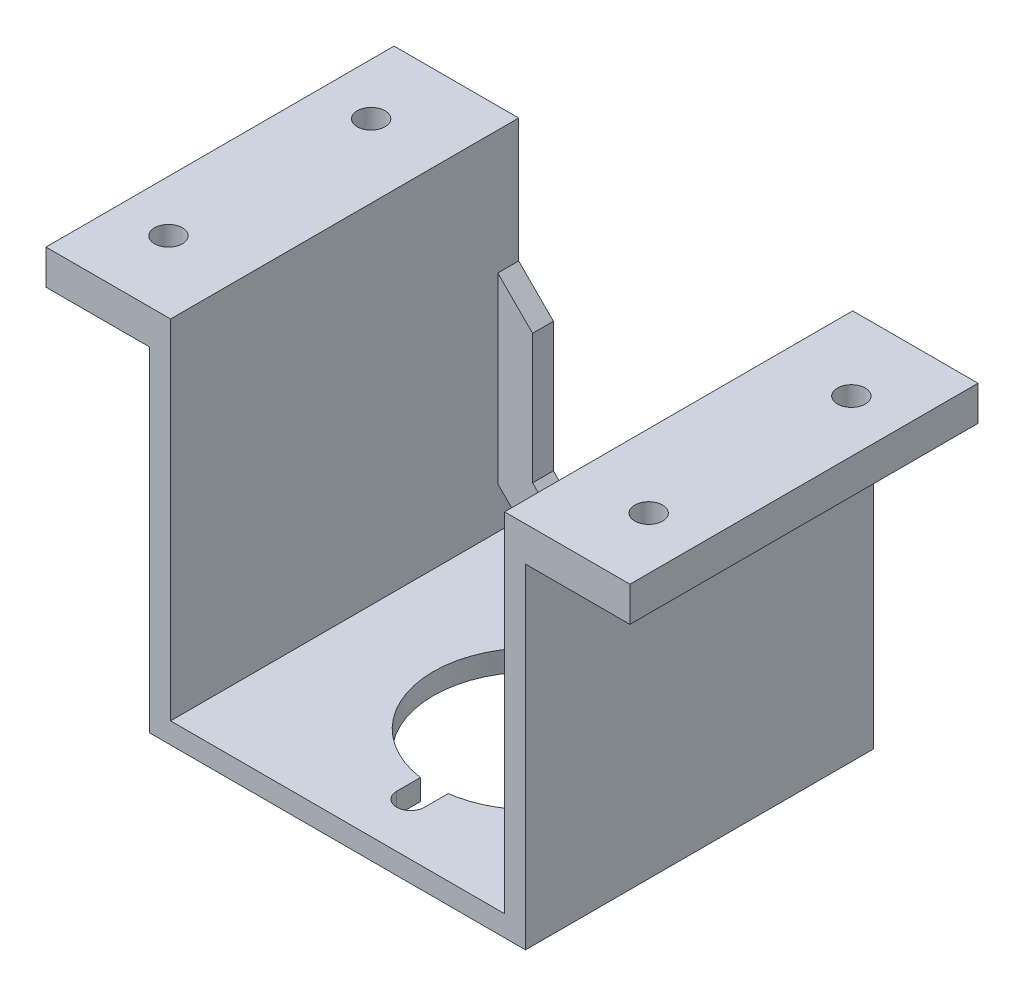
from build123d import *

# Parameters (mm, degrees)
SKETCH1_W                = 50
SKETCH1_H                = 40
BOSS_EXTRUDE1_DEPTH      = 3
SKETCH6_R                = 2
CUT_EXTRUDE9_DEPTH       = 5
SKETCH16_W               = 14.8
SKETCH16_H               = 3
CUT_EXTRUDE10_DEPTH      = 0.5
SKETCH21_R               = 14.25
CUT_EXTRUDE15_DEPTH      = 4
CUT_EXTRUDE16_START      = -4
CUT_EXTRUDE16_DEPTH      = 4
SKETCH33_W               = 4
SKETCH33_H               = 35
CUT_EXTRUDE23_DEPTH      = 5
SKETCH34_W               = 49.986920535
SKETCH34_H               = 3
BOSS_EXTRUDE2_DEPTH      = 3
SKETCH35_W               = 50
SKETCH35_H               = 3
BOSS_EXTRUDE3_DEPTH      = 3
SKETCH36_W               = 46
SKETCH36_H               = 3
BOSS_EXTRUDE4_DEPTH      = 4
SKETCH38_W               = 3
SKETCH38_H               = 46
BOSS_EXTRUDE5_DEPTH      = 25
SKETCH39_W               = 45.535565308
SKETCH39_H               = 3
BOSS_EXTRUDE6_DEPTH      = 15
SKETCH40_W               = 46
SKETCH40_H               = 3
BOSS_EXTRUDE7_DEPTH      = 15
SKETCH41_W               = 0.464434692
SKETCH41_H               = 3
BOSS_EXTRUDE8_DEPTH      = 15
SKETCH42_R               = 2
CUT_EXTRUDE24_DEPTH      = 15
SKETCH43_R               = 2
CUT_EXTRUDE25_DEPTH      = 15
BOSS_EXTRUDE10_START     = 1
SKETCH44_W               = 14.986920535
SKETCH44_H               = 46
SKETCH44_R               = 2
BOSS_EXTRUDE10_DEPTH     = 1
BOSS_EXTRUDE11_START     = 1
SKETCH46_W               = 15
SKETCH46_H               = 46
SKETCH46_R               = 2
BOSS_EXTRUDE11_DEPTH     = 1
BOSS_EXTRUDE12_DEPTH     = 2
BOSS_EXTRUDE13_DEPTH     = 2
SKETCH49_W               = 47.986920535
SKETCH49_H               = 2
BOSS_EXTRUDE14_DEPTH     = 10
CUT_EXTRUDE26_DEPTH      = 10
SKETCH51_W               = 15
SKETCH51_H               = 50
SKETCH51_R               = 2
SKETCH51_W_2             = 3.013079465
SKETCH51_W_3             = 3
BOSS_EXTRUDE15_DEPTH     = 25
CUT_EXTRUDE27_DEPTH      = 63.345980453
CUT_EXTRUDE27_DEPTH_BACK = 63.345980453
SKETCH53_R               = 2
SKETCH54_W               = 15
SKETCH54_H               = 50
CUT_EXTRUDE28_DEPTH      = 48
SKETCH55_W               = 46
SKETCH55_H               = 4
CUT_EXTRUDE29_DEPTH      = 3
SKETCH56_W               = 5
SKETCH56_H               = 5
BOSS_EXTRUDE18_DEPTH     = 1
BOSS_EXTRUDE19_DEPTH     = 2
CUT_EXTRUDE30_DEPTH      = 3


with BuildPart() as part:
    # Sketch1 → Boss-Extrude1 (new body)
    with BuildSketch(Plane(origin=(0, 0, 0), x_dir=(1, 0, 0), z_dir=(0, 1, 0))):
        with Locations((1.920937393, -5.615172506)):
            Rectangle(SKETCH1_W, SKETCH1_H)
    extrude(amount=BOSS_EXTRUDE1_DEPTH)

    # Sketch6 → Cut-Extrude9 (cut)
    with BuildSketch(Plane.XZ):
        with Locations(Location((6.920937393, 23.115172506, 0), (0, 0, 270))):
            Circle(SKETCH6_R)
        with Locations(Location((6.920937393, -11.884827494, 0), (0, 0, 270))):
            Circle(SKETCH6_R)
        with BuildLine():
            Line((24.420937393, 13.015172506), (18.923020545, 13.015172506))
            ThreePointArc((18.923020545, 13.015172506), (-7.179062607, 5.615172506), (18.923020545, -1.784827494))
            Line((18.923020545, -1.784827494), (24.420937393, -1.784827494))
            Line((24.420937393, -1.784827494), (24.420937393, 5.615172506))
            Line((24.420937393, 5.615172506), (24.420937393, 13.015172506))
        make_face()
    extrude(amount=-CUT_EXTRUDE9_DEPTH, mode=Mode.SUBTRACT)

    # Sketch16 → Cut-Extrude10 (cut)
    with BuildSketch(Plane.ZY.offset(-24.420937393)):
        with Locations((5.615172506, 1.5)):
            Rectangle(SKETCH16_W, SKETCH16_H)
    extrude(amount=-CUT_EXTRUDE10_DEPTH, mode=Mode.SUBTRACT)

    # Sketch21 → Cut-Extrude15 (cut)
    with BuildSketch(Plane(origin=(0, 0, 0), x_dir=(-1, 0, 0), z_dir=(0, -1, 0))):
        with Locations((-6.920937393, -5.615172506)):
            Circle(SKETCH21_R)
    extrude(amount=-CUT_EXTRUDE15_DEPTH, mode=Mode.SUBTRACT)

    # Sketch22 → Cut-Extrude16 (cut)
    with BuildSketch(Plane(origin=(0, 3, 0), x_dir=(1, 0, 0), z_dir=(0, 1, 0)).offset(CUT_EXTRUDE16_START)):
        with BuildLine():
            ThreePointArc((21.106680727, 1.784827494), (20.39103932, 3.019158274), (19.568281538, 4.184827494))
            Line((19.568281538, 4.184827494), (17.266105347, 4.184827494))
            ThreePointArc((17.266105347, 4.184827494), (18.246250908, 3.03351374), (19.09888878, 1.784827494))
            Line((19.09888878, 1.784827494), (21.106680727, 1.784827494))
        make_face()
        with BuildLine():
            Line((17.266105347, -15.415172506), (19.568281538, -15.415172506))
            ThreePointArc((19.568281538, -15.415172506), (20.39103932, -14.249503286), (21.106680727, -13.015172506))
            Line((21.106680727, -13.015172506), (19.09888878, -13.015172506))
            ThreePointArc((19.09888878, -13.015172506), (18.246250908, -14.263858752), (17.266105347, -15.415172506))
        make_face()
    extrude(amount=CUT_EXTRUDE16_DEPTH, mode=Mode.SUBTRACT)

    # Sketch33 → Cut-Extrude23 (cut)
    with BuildSketch(Plane(origin=(0, 3, 0), x_dir=(1, 0, 0), z_dir=(0, 1, 0))):
        with Locations((6.920937393, -5.615172506)):
            Rectangle(SKETCH33_W, SKETCH33_H)
    extrude(amount=-CUT_EXTRUDE23_DEPTH, mode=Mode.SUBTRACT)

    # Sketch34 → Boss-Extrude2 (add)
    with BuildSketch(Plane(origin=(0, 0, -14.384827494), x_dir=(-1, 0, 0), z_dir=(0, 0, -1))):
        with Locations((-1.927477126, 1.5)):
            Rectangle(SKETCH34_W, SKETCH34_H)
    extrude(amount=BOSS_EXTRUDE2_DEPTH)

    # Sketch35 → Boss-Extrude3 (add)
    with BuildSketch(Plane.XY.offset(25.615172506)):
        with Locations((1.920937393, 1.5)):
            Rectangle(SKETCH35_W, SKETCH35_H)
    extrude(amount=BOSS_EXTRUDE3_DEPTH)

    # Sketch36 → Boss-Extrude4 (add)
    with BuildSketch(Plane(origin=(26.920937393, 0, 0), x_dir=(0, 0, -1), z_dir=(1, 0, 0))):
        with Locations((-5.615172506, 1.5)):
            Rectangle(SKETCH36_W, SKETCH36_H)
    extrude(amount=BOSS_EXTRUDE4_DEPTH)

    # Sketch38 → Boss-Extrude5 (add)
    with BuildSketch(Plane(origin=(0, 3, 0), x_dir=(1, 0, 0), z_dir=(0, 1, 0))):
        with Locations((29.420937393, -5.615172506)):
            Rectangle(SKETCH38_W, SKETCH38_H)
        with Locations((-21.565983142, -5.615172506)):
            Rectangle(SKETCH38_W, SKETCH38_H)
    extrude(amount=BOSS_EXTRUDE5_DEPTH)

    # Sketch39 → Boss-Extrude6 (add)
    with BuildSketch(Plane.ZY.offset(23.065983142)):
        with Locations((5.38295516, 26.5)):
            Rectangle(SKETCH39_W, SKETCH39_H)
    extrude(amount=BOSS_EXTRUDE6_DEPTH)

    # Sketch40 → Boss-Extrude7 (add)
    with BuildSketch(Plane(origin=(30.920937393, 0, 0), x_dir=(0, 0, -1), z_dir=(1, 0, 0))):
        with Locations((-5.615172506, 26.5)):
            Rectangle(SKETCH40_W, SKETCH40_H)
    extrude(amount=BOSS_EXTRUDE7_DEPTH)

    # Sketch41 → Boss-Extrude8 (add)
    with BuildSketch(Plane.ZY.offset(23.065983142)):
        with Locations((28.38295516, 26.5)):
            Rectangle(SKETCH41_W, SKETCH41_H)
    extrude(amount=BOSS_EXTRUDE8_DEPTH)

    # Sketch42 → Cut-Extrude24 (cut)
    with BuildSketch(Plane.XZ.offset(-25)):
        with Locations(Location((38.420937393, 20.419520332, 0), (0, 0, 270))):
            Circle(SKETCH42_R)
        with Locations(Location((38.420937393, -8.692413747, 0), (0, 0, 270))):
            Circle(SKETCH42_R)
    extrude(amount=-CUT_EXTRUDE24_DEPTH, mode=Mode.SUBTRACT)

    # Sketch43 → Cut-Extrude25 (cut)
    with BuildSketch(Plane.XZ.offset(-25)):
        with Locations(Location((-30.565983142, 20.419520332, 0), (0, 0, 270))):
            Circle(SKETCH43_R)
        with Locations(Location((-30.565983142, -8.692413747, 0), (0, 0, 270))):
            Circle(SKETCH43_R)
    extrude(amount=-CUT_EXTRUDE25_DEPTH, mode=Mode.SUBTRACT)

    # Sketch44 → Boss-Extrude10 (add)
    with BuildSketch(Plane.XZ.offset(-25).offset(BOSS_EXTRUDE10_START)):
        with Locations((-30.572522875, 5.615172506)):
            Rectangle(SKETCH44_W, SKETCH44_H)
        with Locations(Location((-30.565983142, -8.692413747, 0), (0, 0, 270))):
            Circle(SKETCH44_R, mode=Mode.SUBTRACT)
        with Locations(Location((-30.565983142, 20.419520332, 0), (0, 0, 270))):
            Circle(SKETCH44_R, mode=Mode.SUBTRACT)
    extrude(amount=-BOSS_EXTRUDE10_DEPTH)

    # Sketch46 → Boss-Extrude11 (add)
    with BuildSketch(Plane.XZ.offset(-25).offset(BOSS_EXTRUDE11_START)):
        with Locations((38.420937393, 5.615172506)):
            Rectangle(SKETCH46_W, SKETCH46_H)
        with Locations(Location((38.420937393, -8.692413747, 0), (0, 0, 270))):
            Circle(SKETCH46_R, mode=Mode.SUBTRACT)
        with Locations(Location((38.420937393, 20.419520332, 0), (0, 0, 270))):
            Circle(SKETCH46_R, mode=Mode.SUBTRACT)
    extrude(amount=-BOSS_EXTRUDE11_DEPTH)

    # Sketch47 → Boss-Extrude12 (add)
    with BuildSketch(Plane(origin=(0, 0, -17.384827494), x_dir=(-1, 0, 0), z_dir=(0, 0, -1))):
        Polygon((-27.920937393, 28), (-45.920937393, 28), (-45.920937393, 24), (-30.920937393, 24), (-30.920937393, 0), (23.065983142, 0), (23.065983142, 3), (23.065983142, 25), (23.079062607, 25), (23.079062607, 24), (37.960253495, 24), (37.960253495, 28), (20.065983142, 28), (20.065983142, 3), (-27.920937393, 3), align=None)
    extrude(amount=BOSS_EXTRUDE12_DEPTH)

    # Sketch48 → Boss-Extrude13 (add)
    with BuildSketch(Plane.XY.offset(28.615172506)):
        Polygon((-20.065983142, 28), (-37.960253495, 28), (-37.960253495, 24), (-23.079062607, 24), (-23.079062607, 25), (-23.065983142, 25), (-23.065983142, 3), (-23.065983142, 0), (30.920937393, 0), (30.920937393, 24), (45.920937393, 24), (45.920937393, 28), (27.920937393, 28), (27.920937393, 3), (-20.065983142, 3), align=None)
    extrude(amount=BOSS_EXTRUDE13_DEPTH)

    # Sketch49 → Boss-Extrude14 (add)
    with BuildSketch(Plane(origin=(0, 3, 0), x_dir=(1, 0, 0), z_dir=(0, 1, 0))):
        with Locations((3.927477126, 18.384827494)):
            Rectangle(SKETCH49_W, SKETCH49_H)
    extrude(amount=BOSS_EXTRUDE14_DEPTH)

    # Sketch50 → Cut-Extrude26 (cut)
    with BuildSketch(Plane.XY.offset(-17.384827494)):
        Polygon((-20.065983142, 13), (-9.830586805, 2.764603663), (17.920937393, 3), (27.920937393, 13), align=None)
    extrude(amount=-CUT_EXTRUDE26_DEPTH, mode=Mode.SUBTRACT)

    # Sketch51 → Boss-Extrude15 (add)
    # profile 1 of 4: a face of its own
    with BuildSketch(Plane(origin=(0, 28, 0), x_dir=(1, 0, 0), z_dir=(0, 1, 0))):
        with Locations((38.420937393, -5.615172506)):
            Rectangle(SKETCH51_W, SKETCH51_H)
        with Locations(Location((38.420937393, -20.419520332, 0), (0, 0, 90))):
            Circle(SKETCH51_R, mode=Mode.SUBTRACT)
        with Locations(Location((38.420937393, 8.692413747, 0), (0, 0, 90))):
            Circle(SKETCH51_R, mode=Mode.SUBTRACT)
    # profile 2 of 4: a face of its own
    with BuildSketch(Plane(origin=(0, 28, 0), x_dir=(1, 0, 0), z_dir=(0, 1, 0))):
        Polygon((-23.079062607, 19.384827494), (-37.960253495, 19.384827494), (-37.960253495, 17.384827494), (-37.960253495, -28.615172506), (-37.960253495, -30.615172506), (-23.079062607, -30.615172506), align=None)
    # profile 3 of 4: a face of its own
    with BuildSketch(Plane(origin=(0, 28, 0), x_dir=(1, 0, 0), z_dir=(0, 1, 0))):
        with Locations((-21.572522875, -5.615172506)):
            Rectangle(SKETCH51_W_2, SKETCH51_H)
    # profile 4 of 4: a face of its own
    with BuildSketch(Plane(origin=(0, 28, 0), x_dir=(1, 0, 0), z_dir=(0, 1, 0))):
        with Locations((29.420937393, -5.615172506)):
            Rectangle(SKETCH51_W_3, SKETCH51_H)
    extrude(amount=BOSS_EXTRUDE15_DEPTH)

    # Sketch53 → Cut-Extrude27 (cut, two sides: drawn at the far end of the back side and taken through both)
    with BuildSketch(Plane.XZ.offset(-24).offset(-CUT_EXTRUDE27_DEPTH_BACK)):
        with Locations(Location((-30.565983142, 20.419520332, 0), (0, 0, 270))):
            Circle(SKETCH53_R)
        with Locations(Location((-30.565983142, -8.692413747, 0), (0, 0, 270))):
            Circle(SKETCH53_R)
    extrude(amount=CUT_EXTRUDE27_DEPTH + CUT_EXTRUDE27_DEPTH_BACK, mode=Mode.SUBTRACT)

    # Sketch54 → Cut-Extrude28 (cut)
    with BuildSketch(Plane(origin=(0, 0, 0), x_dir=(-1, 0, 0), z_dir=(0, -1, 0))):
        Polygon((23.079062607, -30.615172506), (37.960253495, -30.615172506), (37.960253495, 19.384827494), (23.079062607, 19.384827494), (23.079062607, 14.384827494), (23.079062607, -28.615172506), align=None)
        with Locations((-38.420937393, -5.615172506)):
            Rectangle(SKETCH54_W, SKETCH54_H)
    extrude(amount=-CUT_EXTRUDE28_DEPTH, mode=Mode.SUBTRACT)


with BuildPart() as cut_extrude28_piece_1:
    # of the separate pieces the step leaves, piece 1, a body of its own (cut_extrude28_pieces)
    add(part.part.solids().sort_by_distance((-23.079062607, 0, -14.384827494))[0])

    # Sketch56 → Boss-Extrude18 (add)
    with BuildSketch(Plane.XY.offset(-17.384827494)):
        Polygon((-11.456856729, 8), (-15.065983142, 11.609126412), (-15.065983142, 8), align=None)
        Polygon((-6.456856729, 3), (-11.456856729, 8), (-15.065983142, 8), (-10.065983142, 3), align=None)
        Polygon((-15.065983142, 11.609126412), (-20.065983142, 16.609126412), (-20.065983142, 13), (-15.065983142, 8), align=None)
        Polygon((-20.065983142, 30.218252825), (-20.065983142, 16.609126412), (-15.065983142, 30.218252825), align=None)
        Polygon((-15.065983142, 30.218252825), (-20.065983142, 16.609126412), (-15.065983142, 11.609126412), align=None)
        Polygon((19.31181098, 8), (-11.456856729, 8), (-6.456856729, 3), (14.31181098, 3), align=None)
        Polygon((22.920937393, 8), (19.31181098, 8), (14.31181098, 3), (22.920937393, 3), align=None)
        Polygon((22.920937393, 11.609126412), (19.31181098, 8), (22.920937393, 8), align=None)
        Polygon((22.920937393, 11.609126412), (22.920937393, 8), (27.920937393, 8), (27.920937393, 16.609126412), align=None)
        Polygon((22.920937393, 30.218252825), (22.920937393, 11.609126412), (27.920937393, 16.609126412), (27.920937393, 30.218252825), align=None)
        Polygon((-15.065983142, 30.218252825), (-20.065983142, 35.218252825), (-20.065983142, 30.218252825), align=None)
        Polygon((27.920937393, 35.218252825), (27.920937393, 30.218252825), (22.920937393, 30.218252825), align=None)
        with Locations((25.420937393, 5.5)):
            Rectangle(SKETCH56_W, SKETCH56_H)
        with Locations((-17.565983142, 5.5)):
            Rectangle(SKETCH56_W, SKETCH56_H)
        Polygon((-10.065983142, 3), (-15.065983142, 8), (-15.065983142, 3), align=None)
        Polygon((-15.065983142, 8), (-20.065983142, 13), (-20.065983142, 8), align=None)
    extrude(amount=BOSS_EXTRUDE18_DEPTH)

    # Sketch57 → Boss-Extrude19 (add)
    with BuildSketch(Plane(origin=(0, 0, -17.384827494), x_dir=(-1, 0, 0), z_dir=(0, 0, -1))):
        Polygon((-22.920937393, 30.218252825), (-27.920937393, 35.218252825), (-27.920937393, 13), (-17.920937393, 3), (10.065983142, 3), (20.065983142, 13), (20.065983142, 35.218252825), (15.065983142, 30.218252825), (15.065983142, 11.609126412), (11.456856729, 8), (-19.31181098, 8), (-22.920937393, 11.609126412), align=None)
    extrude(amount=BOSS_EXTRUDE19_DEPTH)

    # Sketch58 → Cut-Extrude30 (cut)
    with BuildSketch(Plane.XY.offset(-16.384827494)):
        Polygon((-20.065983142, 3), (-14.065983142, 3), (-20.065983142, 9), align=None)
        Polygon((27.920937393, 3), (27.920937393, 9), (21.920937393, 3), align=None)
    extrude(amount=-CUT_EXTRUDE30_DEPTH, mode=Mode.SUBTRACT)


with BuildPart() as cut_extrude28_piece_2:
    # of the separate pieces the step leaves, piece 2, a body of its own (cut_extrude28_pieces)
    add(part.part.solids().sort_by_distance((-37.960253495, 24, 28.615172506))[0])

    # Sketch55 → Cut-Extrude29 (cut)
    with BuildSketch(Plane.ZY.offset(38.065983142)):
        with Locations((5.615172506, 26)):
            Rectangle(SKETCH55_W, SKETCH55_H)
    extrude(amount=-CUT_EXTRUDE29_DEPTH, mode=Mode.SUBTRACT)


solid = cut_extrude28_piece_1.part
